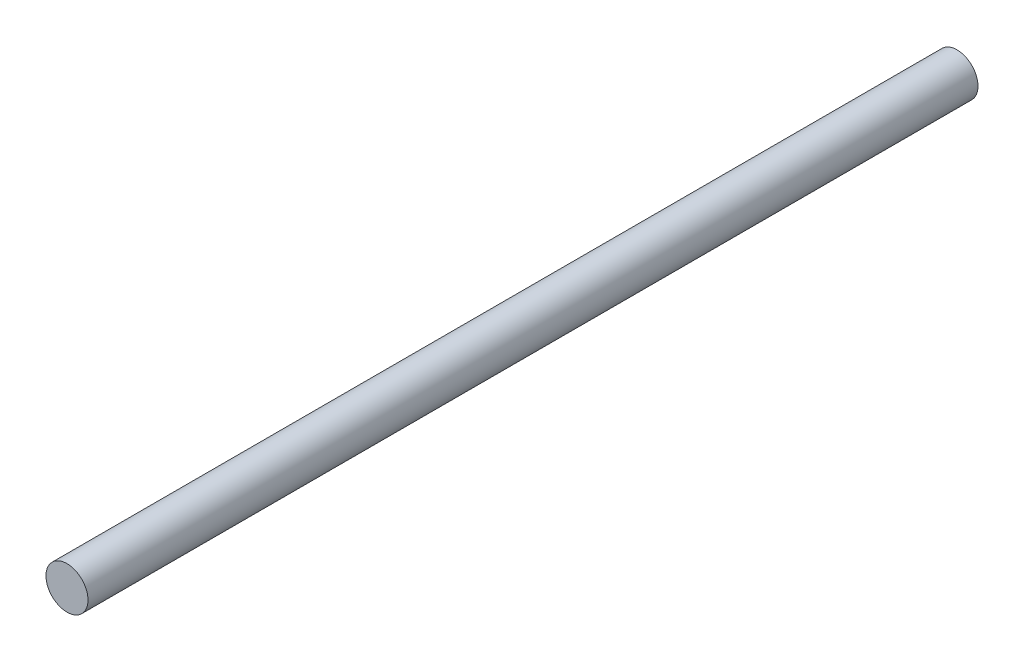
from build123d import *

# Parameters (mm, degrees)
CROQUIS1_R              = 3
SALIENTE_EXTRUIR1_DEPTH = 63.5


with BuildPart() as part:
    # Croquis1 → Saliente-Extruir1 (new, symmetric)
    with BuildSketch(Plane.XY):
        Circle(CROQUIS1_R)
    extrude(amount=SALIENTE_EXTRUIR1_DEPTH, both=True)


solid = part.part
